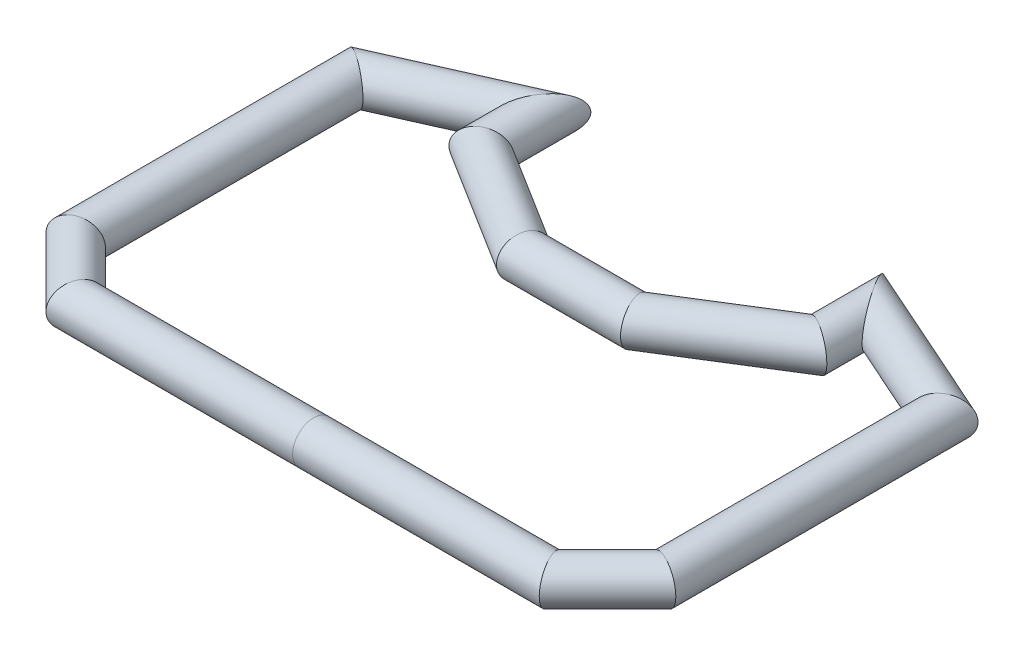
from build123d import *

# Parameters (mm, degrees)
SKETCH2_R = 19.05


with BuildPart() as part:
    # Sweep1: sweep along a path in Sketch1
    with BuildLine(Plane(origin=(0, 0, 0), x_dir=(1, 0, 0), z_dir=(0, 1, 0))) as sweep1_path:
        Line((-266.7, -373.873558028), (-266.7, -119.873558028))
        Line((-266.7, -119.873558028), (-152.4, -69.073558028))
        Line((-152.4, -69.073558028), (-152.4, -119.873558028))
        Line((-152.4, -119.873558028), (-50.8, -183.373558028))
        Line((-50.8, -183.373558028), (50.8, -183.373558028))
        Line((50.8, -183.373558028), (152.4, -119.873558028))
        Line((152.4, -119.873558028), (152.4, -69.073558028))
        Line((152.4, -69.073558028), (266.7, -119.873558028))
        Line((266.7, -119.873558028), (266.7, -373.873558028))
        Line((266.7, -373.873558028), (215.9, -424.673558028))
        Line((215.9, -424.673558028), (-215.9, -424.673558028))
        Line((-215.9, -424.673558028), (-266.7, -373.873558028))
    # Sketch2 → Sweep1 (sweep)
    with BuildSketch(Plane(origin=(0, 0, 0), x_dir=(0, 0, -1), z_dir=(1, 0, 0))):
        with Locations((-424.673558028, 0)):
            Circle(SKETCH2_R)
    sweep(path=sweep1_path.line, transition=Transition.RIGHT)


solid = part.part
